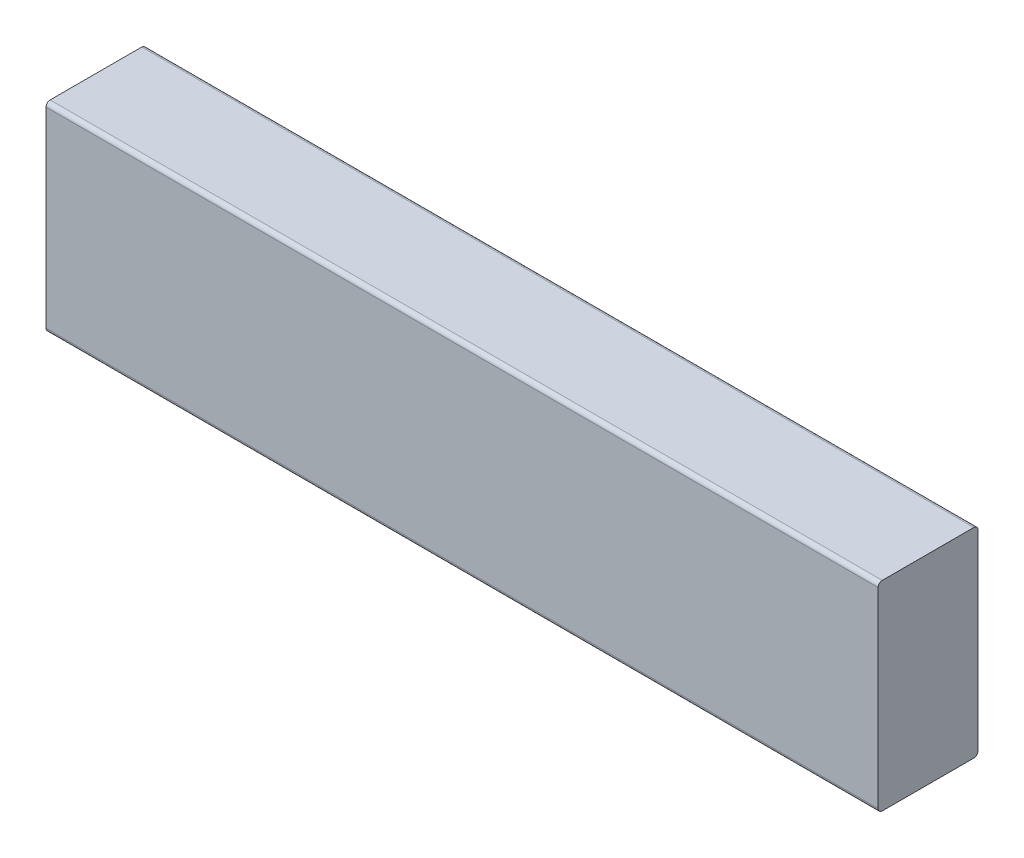
from build123d import *

# Parameters (mm, degrees)
EXTRUDE1_DEPTH = 6
SKETCH2_W      = 50
SKETCH2_H      = 12
EXTRUDE2_DEPTH = 6
FILLET1_R      = 0.25


with BuildPart() as part:
    # Sketch1 → Extrude1 (new body)
    with BuildSketch(Plane.XY):
        with BuildLine():
            Line((0, 6), (-44, 6))
            Line((-44, 6), (-44, -6))
            Line((-44, -6), (0, -6))
            ThreePointArc((0, -6), (6, 0), (0, 6))
        make_face()
    extrude(amount=EXTRUDE1_DEPTH)

    # Sketch2 → Extrude2 (add)
    with BuildSketch(Plane.XY):
        with Locations((-19, 0)):
            Rectangle(SKETCH2_W, SKETCH2_H)
    extrude(amount=EXTRUDE2_DEPTH)

    # Fillet1
    fillet1_edges = [part.edges().sort_by_distance(p)[0] for p in [
        (-19, -6, 6),
        (-19, -6, 0),
        (-19, 6, 0),
        (-19, 6, 6),
    ]]
    fillet(fillet1_edges, radius=FILLET1_R)


solid = part.part
